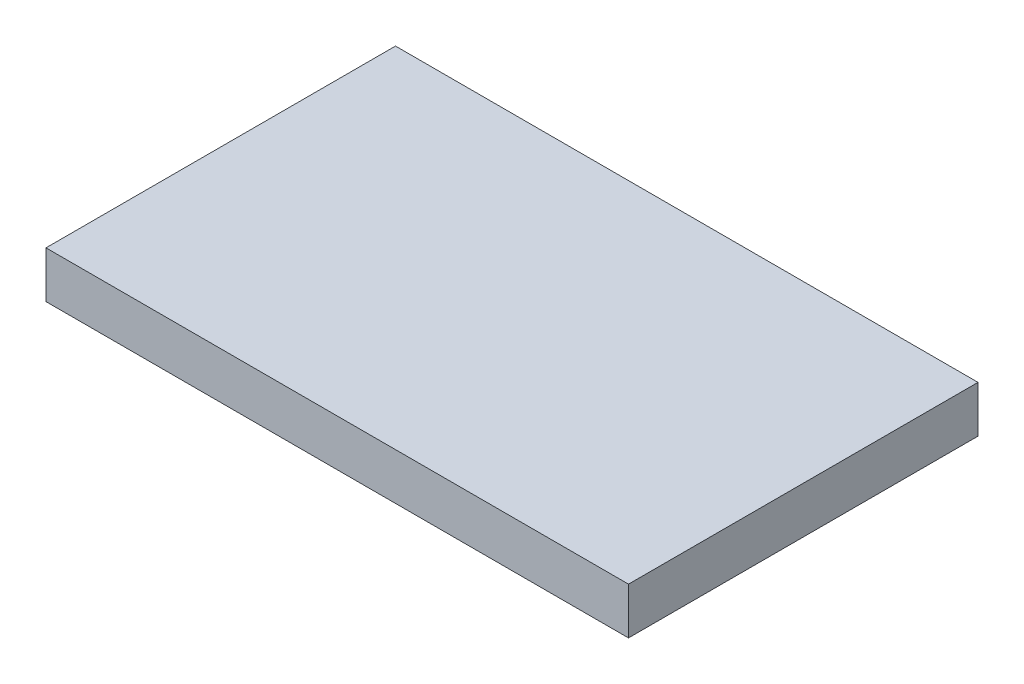
from build123d import *

# Parameters (mm, degrees)
SKETCH_1_W      = 25
SKETCH_1_H      = 15
EXTRUDE_1_DEPTH = 2


with BuildPart() as part:
    # Эскиз1 → Бобышка-Вытянуть1 (new body)
    with BuildSketch(Plane(origin=(0, 0, 0), x_dir=(1, 0, 0), z_dir=(0, 1, 0))):
        Rectangle(SKETCH_1_W, SKETCH_1_H)
    extrude(amount=EXTRUDE_1_DEPTH)


solid = part.part
